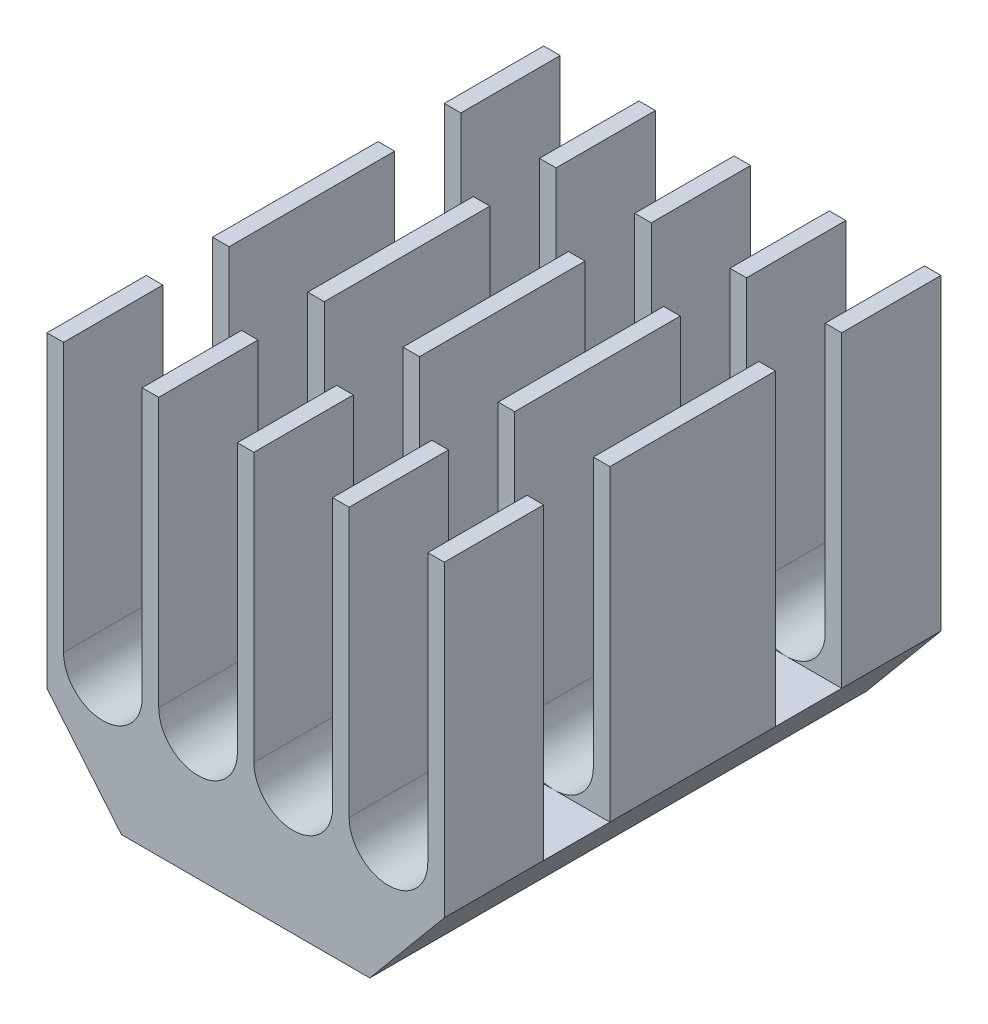
from build123d import *

# Parameters (mm, degrees)
AUFSATZ_LINEAR_AUSTRAGEN1_DEPTH = 7.5
SCHNITT_LINEAR_AUSTRAGEN1_DEPTH = 15
SCHNITT_LINEAR_AUSTRAGEN2_REACH = 20.554
SKIZZE3_W                       = 2
SKIZZE3_H                       = 9.3
SKIZZE4_W                       = 7.3
SKIZZE4_H                       = 14.8
AUFSATZ_LINEAR_AUSTRAGEN2_DEPTH = 0.1


with BuildPart() as part:
    # Skizze1 → Aufsatz-Linear austragen1 (new, symmetric)
    with BuildSketch(Plane.XY):
        Polygon((-6, 12), (-6, 2.7), (-3.75, 0), (3.75, 0), (6, 2.7), (6, 12), align=None)
    extrude(amount=AUFSATZ_LINEAR_AUSTRAGEN1_DEPTH, both=True)

    # Skizze2 → Schnitt-Linear austragen1 (cut)
    with BuildSketch(Plane.XY.offset(7.5)):
        with BuildLine():
            Line((-3.125, 12), (-3.125, 3.8875))
            ThreePointArc((-3.125, 3.8875), (-4.3125, 2.7), (-5.5, 3.8875))
            Line((-5.5, 3.8875), (-5.5, 12))
            ThreePointArc((-5.5, 12), (-4.3125, 13.1875), (-3.125, 12))
        make_face()
        with BuildLine():
            Line((-0.25, 12), (-0.25, 3.8875))
            ThreePointArc((-0.25, 3.8875), (-1.4375, 2.7), (-2.625, 3.8875))
            Line((-2.625, 3.8875), (-2.625, 12))
            ThreePointArc((-2.625, 12), (-1.4375, 13.1875), (-0.25, 12))
        make_face()
        with BuildLine():
            Line((2.625, 12), (2.625, 3.8875))
            ThreePointArc((2.625, 3.8875), (1.4375, 2.7), (0.25, 3.8875))
            Line((0.25, 3.8875), (0.25, 12))
            ThreePointArc((0.25, 12), (1.4375, 13.1875), (2.625, 12))
        make_face()
        with BuildLine():
            Line((5.5, 12), (5.5, 3.8875))
            ThreePointArc((5.5, 3.8875), (4.3125, 2.7), (3.125, 3.8875))
            Line((3.125, 3.8875), (3.125, 12))
            ThreePointArc((3.125, 12), (4.3125, 13.1875), (5.5, 12))
        make_face()
    extrude(amount=-SCHNITT_LINEAR_AUSTRAGEN1_DEPTH, mode=Mode.SUBTRACT)

    # Schnitt-Linear austragen2: up to this face of the body (flat: up to its plane)
    schnitt_linear_austragen2_end = Plane(part.part.faces().sort_by_distance((-6, 7.35, 0))[0])
    # Skizze3 → Schnitt-Linear austragen2 (cut, up to the picked face)
    with BuildSketch(Plane(origin=(6, 0, 0), x_dir=(0, 0, -1), z_dir=(1, 0, 0)), mode=Mode.PRIVATE) as schnitt_linear_austragen2_sk1:
        with Locations((-3.5, 7.35)):
            Rectangle(SKIZZE3_W, SKIZZE3_H)
    schnitt_linear_austragen2_tool1 = split(extrude(schnitt_linear_austragen2_sk1.sketch, amount=-SCHNITT_LINEAR_AUSTRAGEN2_REACH, mode=Mode.PRIVATE), bisect_by=schnitt_linear_austragen2_end, keep=Keep.BOTH, mode=Mode.PRIVATE)
    # Skizze3 → Schnitt-Linear austragen2 (cut, up to the picked face)
    with BuildSketch(Plane(origin=(6, 0, 0), x_dir=(0, 0, -1), z_dir=(1, 0, 0)), mode=Mode.PRIVATE) as schnitt_linear_austragen2_sk2:
        with Locations((3.5, 7.35)):
            Rectangle(SKIZZE3_W, SKIZZE3_H)
    schnitt_linear_austragen2_tool2 = split(extrude(schnitt_linear_austragen2_sk2.sketch, amount=-SCHNITT_LINEAR_AUSTRAGEN2_REACH, mode=Mode.PRIVATE), bisect_by=schnitt_linear_austragen2_end, keep=Keep.BOTH, mode=Mode.PRIVATE)
    # Skizze3 → Schnitt-Linear austragen2 (cut, up to the picked face)
    with BuildSketch(Plane(origin=(6, 0, 0), x_dir=(0, 0, -1), z_dir=(1, 0, 0)), mode=Mode.PRIVATE) as schnitt_linear_austragen2_sk3:
        with Locations((10.5, 7.35)):
            Rectangle(SKIZZE3_W, SKIZZE3_H)
    schnitt_linear_austragen2_tool3 = split(extrude(schnitt_linear_austragen2_sk3.sketch, amount=-SCHNITT_LINEAR_AUSTRAGEN2_REACH, mode=Mode.PRIVATE), bisect_by=schnitt_linear_austragen2_end, keep=Keep.BOTH, mode=Mode.PRIVATE)
    # Skizze3 → Schnitt-Linear austragen2 (cut, up to the picked face)
    with BuildSketch(Plane(origin=(6, 0, 0), x_dir=(0, 0, -1), z_dir=(1, 0, 0)), mode=Mode.PRIVATE) as schnitt_linear_austragen2_sk4:
        with Locations((17.5, 7.35)):
            Rectangle(SKIZZE3_W, SKIZZE3_H)
    schnitt_linear_austragen2_tool4 = split(extrude(schnitt_linear_austragen2_sk4.sketch, amount=-SCHNITT_LINEAR_AUSTRAGEN2_REACH, mode=Mode.PRIVATE), bisect_by=schnitt_linear_austragen2_end, keep=Keep.BOTH, mode=Mode.PRIVATE)
    add(schnitt_linear_austragen2_tool1.solids().sort_by(Axis((6, 7.35, 3.5), (-1, 0, 0)))[0], mode=Mode.SUBTRACT)
    add(schnitt_linear_austragen2_tool2.solids().sort_by(Axis((6, 7.35, -3.5), (-1, 0, 0)))[0], mode=Mode.SUBTRACT)
    add(schnitt_linear_austragen2_tool3.solids().sort_by(Axis((6, 7.35, -10.5), (-1, 0, 0)))[0], mode=Mode.SUBTRACT)
    add(schnitt_linear_austragen2_tool4.solids().sort_by(Axis((6, 7.35, -17.5), (-1, 0, 0)))[0], mode=Mode.SUBTRACT)

    # Skizze4 → Aufsatz-Linear austragen2 (add)
    with BuildSketch(Plane.XZ):
        Rectangle(SKIZZE4_W, SKIZZE4_H)
    extrude(amount=AUFSATZ_LINEAR_AUSTRAGEN2_DEPTH)


solid = part.part
